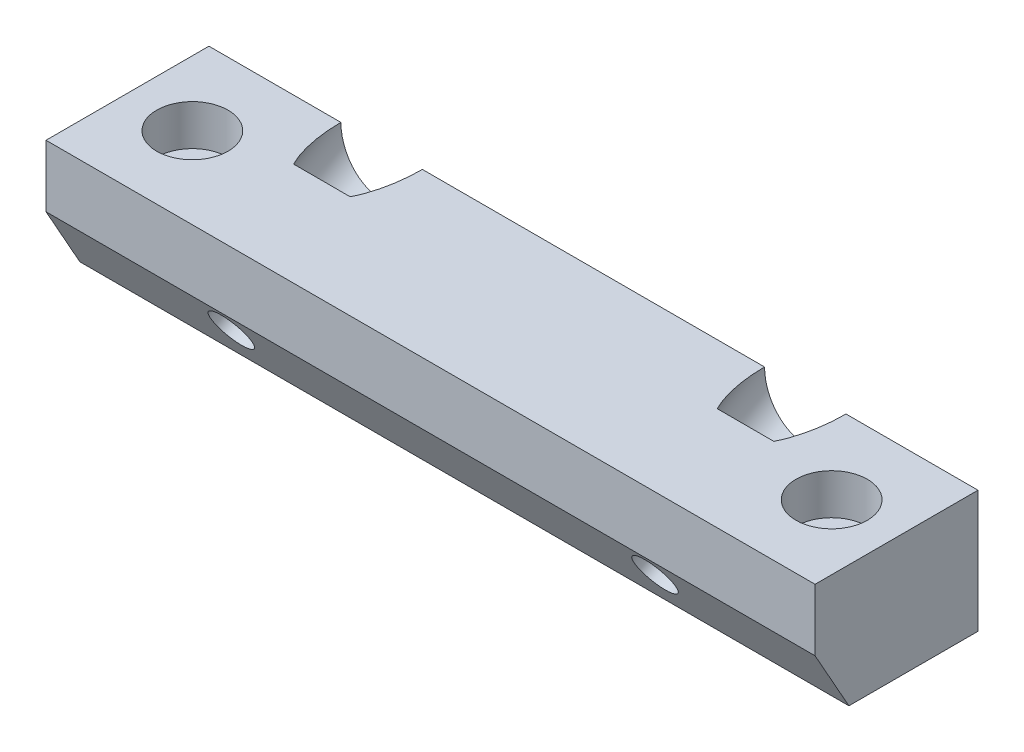
from build123d import *

# Parameters (mm, degrees)
BOSS_EXTRUDE1_DEPTH                              = 119.888
CBORE_FOR_1_4_SOCKET_HEAD_CAP_SCREW1_D           = 6.7564
CBORE_FOR_1_4_SOCKET_HEAD_CAP_SCREW1_CBORE_D     = 11.1125
CBORE_FOR_1_4_SOCKET_HEAD_CAP_SCREW1_CBORE_DEPTH = 6.35
F_5_16_18_TAPPED_HOLE1_D                         = 6.5278
SKETCH6_R                                        = 6.35
CUT_EXTRUDE1_DEPTH                               = 125.150820709


with BuildPart() as part:
    # Sketch1 → Boss-Extrude1 (new body)
    with BuildSketch(Plane(origin=(0, 0, 0), x_dir=(0, 0, -1), z_dir=(1, 0, 0))):
        Polygon((0, 0), (0, 19.05), (-25.4, 19.05), (-25.4, 9.398), (-20.121342373, 0), align=None)
    extrude(amount=BOSS_EXTRUDE1_DEPTH)

    # CBORE for 1/4 Socket Head Cap Screw1 (through all)
    with Locations(Plane(origin=(0, 19.05, 0), x_dir=(1, 0, 0), z_dir=(0, 1, 0))):
        with Locations((10.11555, -12.7), (109.77245, -12.7)):
            CounterBoreHole(CBORE_FOR_1_4_SOCKET_HEAD_CAP_SCREW1_D / 2, CBORE_FOR_1_4_SOCKET_HEAD_CAP_SCREW1_CBORE_D / 2, CBORE_FOR_1_4_SOCKET_HEAD_CAP_SCREW1_CBORE_DEPTH)

    # 5/16-18 Tapped Hole1 (through all)
    with Locations(Plane(origin=(0, 4.568628166, -8.133879962), x_dir=(1, 0, 0), z_dir=(0, 0.48971726622701756, -0.8718812987781861))):
        with Locations((92.964, -16.609338742), (26.924, -16.609338742)):
            Hole(F_5_16_18_TAPPED_HOLE1_D / 2)

    # Sketch6 → Cut-Extrude1 (cut, through all)
    with BuildSketch(Plane(origin=(0, 0.588206226, -1.047228766), x_dir=(1, 0, 0), z_dir=(0, -0.48971726622701756, 0.8718812987781861))):
        with Locations((26.924, 16.609338742)):
            Circle(SKETCH6_R)
        with Locations((92.964, 16.609338742)):
            Circle(SKETCH6_R)
    extrude(amount=-CUT_EXTRUDE1_DEPTH, mode=Mode.SUBTRACT)


solid = part.part
